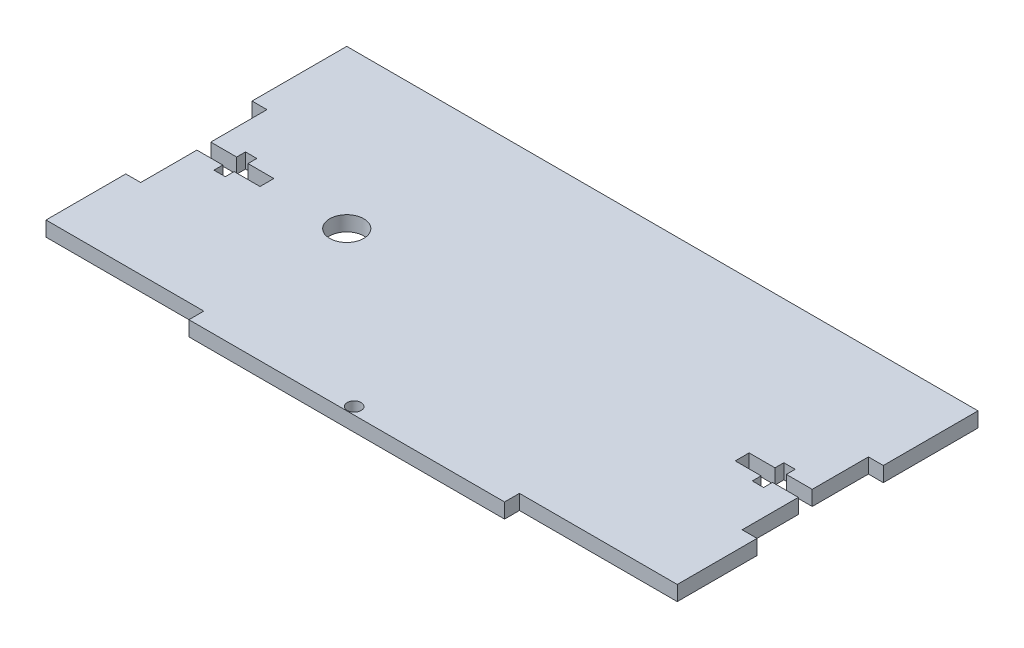
from build123d import *

# Parameters (mm, degrees)
SKETCH1_W           = 127
SKETCH1_H           = 63.5
BOSS_EXTRUDE1_DEPTH = 2.9972
CUT_EXTRUDE1_REACH  = 73.058
SKETCH2_R           = 1.397
SKETCH2_W           = 31.75
SKETCH2_H           = 2.9972
CUT_EXTRUDE2_REACH  = 73.058
SKETCH3_R           = 3.429


with BuildPart() as part:
    # Sketch1 → Boss-Extrude1 (new body)
    with BuildSketch(Plane(origin=(0, 0, 0), x_dir=(1, 0, 0), z_dir=(0, 1, 0))):
        Rectangle(SKETCH1_W, SKETCH1_H)
    extrude(amount=BOSS_EXTRUDE1_DEPTH)

    # Sketch2 → Cut-Extrude1 (cut, up to next)
    with BuildSketch(Plane(origin=(0, 2.9972, 0), x_dir=(1, 0, 0), z_dir=(0, 1, 0)), mode=Mode.PRIVATE) as cut_extrude1_sk1:
        with Locations(Location((0, -30.2514, 0), (0, 0, 90))):
            Circle(SKETCH2_R)
    cut_extrude1_tool1 = extrude(cut_extrude1_sk1.sketch, amount=-CUT_EXTRUDE1_REACH, mode=Mode.PRIVATE) & part.part
    # Sketch2 → Cut-Extrude1 (cut, up to next)
    with BuildSketch(Plane(origin=(0, 2.9972, 0), x_dir=(1, 0, 0), z_dir=(0, 1, 0)), mode=Mode.PRIVATE) as cut_extrude1_sk2:
        with Locations((-47.625, -30.2514)):
            Rectangle(SKETCH2_W, SKETCH2_H)
    cut_extrude1_tool2 = extrude(cut_extrude1_sk2.sketch, amount=-CUT_EXTRUDE1_REACH, mode=Mode.PRIVATE) & part.part
    # Sketch2 → Cut-Extrude1 (cut, up to next)
    with BuildSketch(Plane(origin=(0, 2.9972, 0), x_dir=(1, 0, 0), z_dir=(0, 1, 0)), mode=Mode.PRIVATE) as cut_extrude1_sk3:
        Polygon((-63.5, 12.7), (-60.5028, 12.7), (-60.5028, 1.397), (-55.2958, 1.397), (-55.2958, 3.175), (-53.0098, 3.175), (-53.0098, 1.397), (-47.8028, 1.397), (-47.8028, -1.397), (-53.0098, -1.397), (-53.0098, -3.175), (-55.2958, -3.175), (-55.2958, -1.397), (-60.5028, -1.397), (-60.5028, -12.7), (-63.5, -12.7), align=None)
    cut_extrude1_tool3 = extrude(cut_extrude1_sk3.sketch, amount=-CUT_EXTRUDE1_REACH, mode=Mode.PRIVATE) & part.part
    # Sketch2 → Cut-Extrude1 (cut, up to next)
    with BuildSketch(Plane(origin=(0, 2.9972, 0), x_dir=(1, 0, 0), z_dir=(0, 1, 0)), mode=Mode.PRIVATE) as cut_extrude1_sk4:
        with Locations((47.625, -30.2514)):
            Rectangle(SKETCH2_W, SKETCH2_H)
    cut_extrude1_tool4 = extrude(cut_extrude1_sk4.sketch, amount=-CUT_EXTRUDE1_REACH, mode=Mode.PRIVATE) & part.part
    # Sketch2 → Cut-Extrude1 (cut, up to next)
    with BuildSketch(Plane(origin=(0, 2.9972, 0), x_dir=(1, 0, 0), z_dir=(0, 1, 0)), mode=Mode.PRIVATE) as cut_extrude1_sk5:
        Polygon((60.5028, -1.397), (60.5028, -12.7), (63.5, -12.7), (63.5, 12.7), (60.5028, 12.7), (60.5028, 1.397), (55.2958, 1.397), (55.2958, 3.175), (53.0098, 3.175), (53.0098, 1.397), (47.8028, 1.397), (47.8028, -1.397), (53.0098, -1.397), (53.0098, -3.175), (55.2958, -3.175), (55.2958, -1.397), align=None)
    cut_extrude1_tool5 = extrude(cut_extrude1_sk5.sketch, amount=-CUT_EXTRUDE1_REACH, mode=Mode.PRIVATE) & part.part
    add(cut_extrude1_tool1.solids().sort_by_distance((0, 2.9972, 30.2514))[0], mode=Mode.SUBTRACT)
    add(cut_extrude1_tool2.solids().sort_by_distance((-47.625, 2.9972, 30.2514))[0], mode=Mode.SUBTRACT)
    add(cut_extrude1_tool3.solids().sort_by_distance((-59.14275, 2.9972, 0))[0], mode=Mode.SUBTRACT)
    add(cut_extrude1_tool4.solids().sort_by_distance((47.625, 2.9972, 30.2514))[0], mode=Mode.SUBTRACT)
    add(cut_extrude1_tool5.solids().sort_by_distance((59.14275, 2.9972, 0))[0], mode=Mode.SUBTRACT)

    # Sketch3 → Cut-Extrude2 (cut, up to next)
    with BuildSketch(Plane(origin=(0, 2.9972, 0), x_dir=(1, 0, 0), z_dir=(0, 1, 0)), mode=Mode.PRIVATE) as cut_extrude2_sk1:
        with Locations(Location((-31.75, 0, 0), (0, 0, 270))):
            Circle(SKETCH3_R)
    cut_extrude2_tool1 = extrude(cut_extrude2_sk1.sketch, amount=-CUT_EXTRUDE2_REACH, mode=Mode.PRIVATE) & part.part
    add(cut_extrude2_tool1.solids().sort_by_distance((-31.75, 2.9972, 0))[0], mode=Mode.SUBTRACT)


solid = part.part
